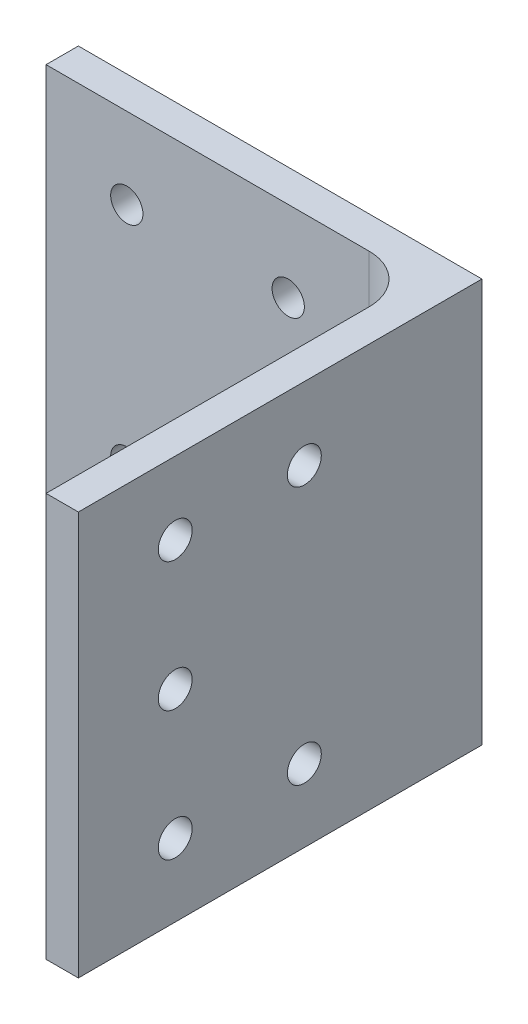
from build123d import *

# Parameters (mm, degrees)
SKETCH_1_W                  = 25
SKETCH_1_H                  = 25
EXTRUDE_1_DEPTH             = 25
SKETCH_2_W                  = 23
SKETCH_2_H                  = 23
CUT_EXTRUDE_1_DEPTH         = 44.301270189
HOLE_WIZARD_2_0_2_1_D       = 2
HOLE_WIZARD_2_1_2_1_1_D     = 2.1
HOLE_WIZARD_2_1_2_1_1_DEPTH = 25
FILLET_1_R                  = 3


with BuildPart() as part:
    # 草图1 → 凸台-拉伸1 (new body)
    with BuildSketch(Plane.XY.offset(25)):
        with Locations((-12.5, 12.5)):
            Rectangle(SKETCH_1_W, SKETCH_1_H)
    extrude(amount=-EXTRUDE_1_DEPTH)

    # 草图2 → 切除-拉伸1 (cut, through all)
    with BuildSketch(Plane.XZ):
        with Locations((-13.5, 13.5)):
            Rectangle(SKETCH_2_W, SKETCH_2_H)
    extrude(amount=-CUT_EXTRUDE_1_DEPTH, mode=Mode.SUBTRACT)

    # Ø2.0 (2) 直径孔1 (through all)
    with Locations(Plane.XY.offset(2)):
        with Locations((-10, 20), (-10, 6), (-20, 6), (-20, 19.98825417)):
            Hole(HOLE_WIZARD_2_0_2_1_D / 2)

    # Ø2.1 (2.1) 直径孔1
    with Locations(Plane(origin=(0, 0, 0), x_dir=(0, 0, -1), z_dir=(1, 0, 0))):
        with Locations((-19, 20.5), (-19, 4.5), (-19, 12.5), (-11, 4.5), (-11, 20.5)):
            Hole(HOLE_WIZARD_2_1_2_1_1_D / 2, depth=HOLE_WIZARD_2_1_2_1_1_DEPTH)

    # 圆角1
    fillet_1_edges = [part.edges().sort_by_distance(p)[0] for p in [
        (-2, 12.5, 2),
    ]]
    fillet(fillet_1_edges, radius=FILLET_1_R)


solid = part.part
